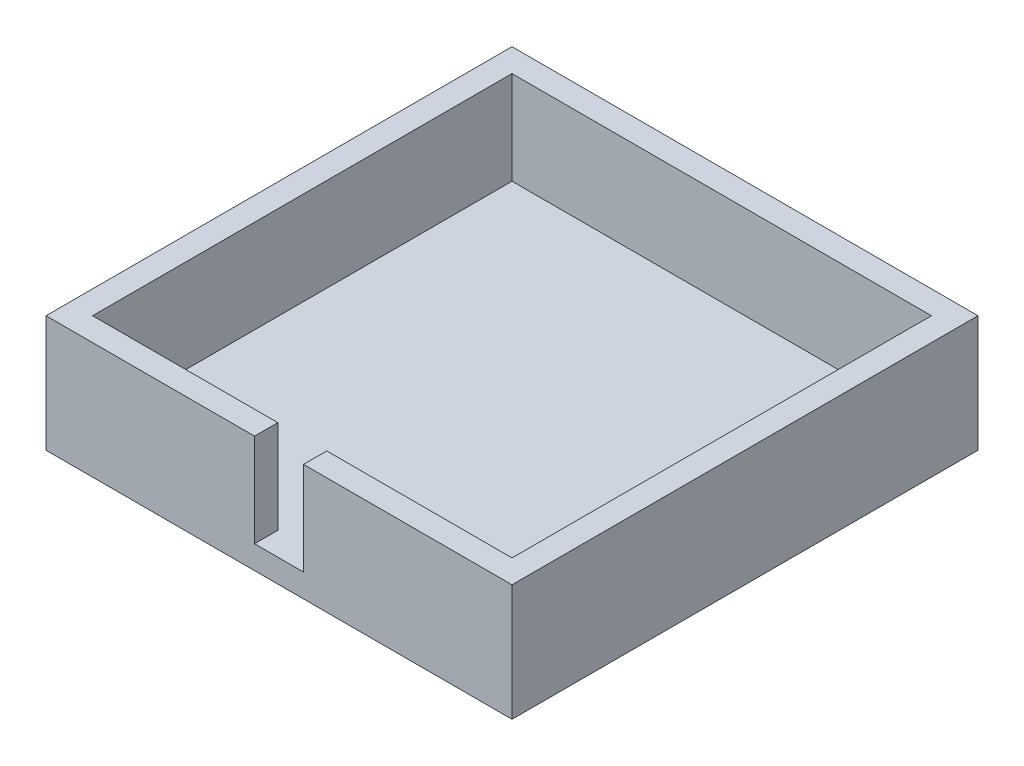
from build123d import *

# Parameters (mm, degrees)
SKETCH1_W               = 200
SKETCH1_H               = 200
BOSS_EXTRUDE1_DEPTH     = 50
CUT_EXTRUDE1_DEPTH      = 151
CUT_EXTRUDE1_DEPTH_BACK = 40
SKETCH2_W               = 180
SKETCH2_H               = 180
SKETCH3_W               = 21
SKETCH3_H               = 40
CUT_EXTRUDE2_DEPTH      = 40


with BuildPart() as part:
    # Sketch1 → Boss-Extrude1 (new body)
    with BuildSketch(Plane(origin=(0, 0, 0), x_dir=(1, 0, 0), z_dir=(0, 1, 0))):
        Rectangle(SKETCH1_W, SKETCH1_H)
    extrude(amount=BOSS_EXTRUDE1_DEPTH)

    # Sketch2 → Cut-Extrude1 (cut, two sides: drawn at the far end of the back side and taken through both)
    with BuildSketch(Plane(origin=(0, 50, 0), x_dir=(1, 0, 0), z_dir=(0, 1, 0)).offset(-CUT_EXTRUDE1_DEPTH_BACK)):
        Rectangle(SKETCH2_W, SKETCH2_H)
    extrude(amount=CUT_EXTRUDE1_DEPTH + CUT_EXTRUDE1_DEPTH_BACK, mode=Mode.SUBTRACT)

    # Sketch3 → Cut-Extrude2 (cut)
    with BuildSketch(Plane.XY.offset(100)):
        with Locations((0, 30)):
            Rectangle(SKETCH3_W, SKETCH3_H)
    extrude(amount=-CUT_EXTRUDE2_DEPTH, mode=Mode.SUBTRACT)


solid = part.part
